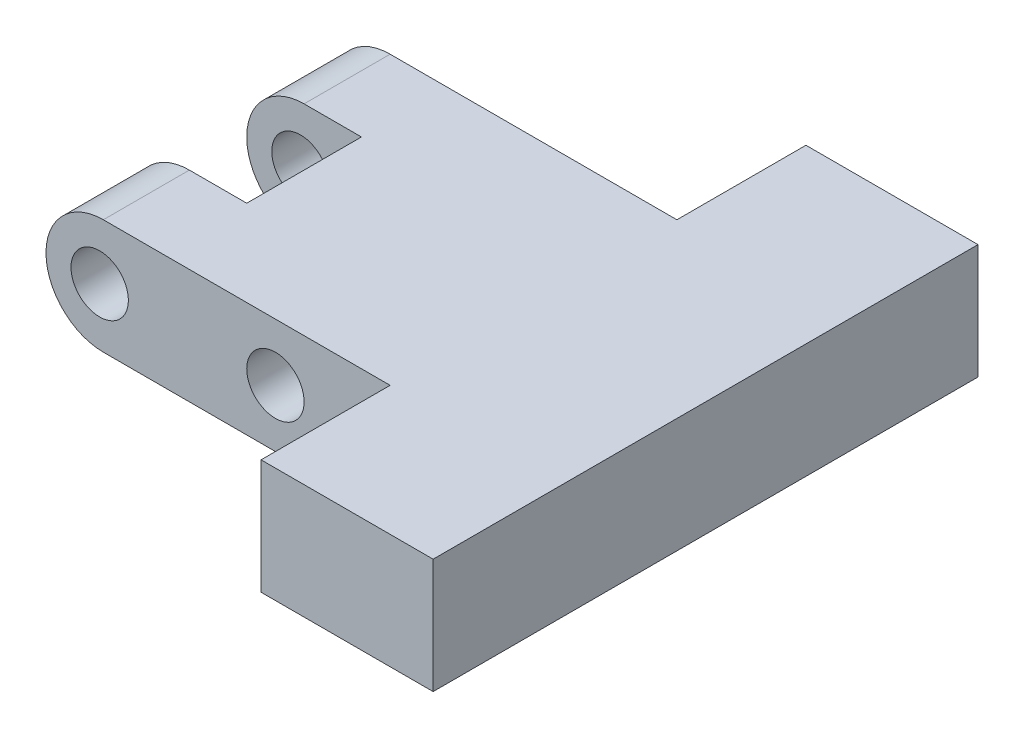
from build123d import *

# Parameters (mm, degrees)
SKETCH1_W           = 6
SKETCH1_H           = 19
SKETCH1_W_2         = 8
SKETCH1_H_2         = 10
BOSS_EXTRUDE1_DEPTH = 4
BOSS_EXTRUDE2_DEPTH = 3
BOSS_EXTRUDE3_START = -3
BOSS_EXTRUDE3_DEPTH = 3
SKETCH6_R           = 1
CUT_EXTRUDE1_DEPTH  = 14
SKETCH7_R           = 1
CUT_EXTRUDE2_DEPTH  = 14


with BuildPart() as part:
    # Sketch1 → Boss-Extrude1 (new body)
    with BuildSketch(Plane(origin=(0, 0, 0), x_dir=(1, 0, 0), z_dir=(0, 1, 0))):
        with Locations((3, 9.5)):
            Rectangle(SKETCH1_W, SKETCH1_H)
        with Locations((-4, 9.5)):
            Rectangle(SKETCH1_W_2, SKETCH1_H_2)
    extrude(amount=BOSS_EXTRUDE1_DEPTH)

    # Sketch2 → Boss-Extrude2 (add)
    with BuildSketch(Plane.XY.offset(-4.5)):
        with BuildLine():
            Line((-8, 0), (-10, 0))
            ThreePointArc((-10, 0), (-12, 2), (-10, 4))
            Line((-10, 4), (-8, 4))
            Line((-8, 4), (-8, 0))
        make_face()
    extrude(amount=-BOSS_EXTRUDE2_DEPTH)

    # Sketch5 → Boss-Extrude3 (add)
    with BuildSketch(Plane(origin=(0, 0, -14.5), x_dir=(-1, 0, 0), z_dir=(0, 0, -1)).offset(BOSS_EXTRUDE3_START)):
        with BuildLine():
            Line((8, 4), (10, 4))
            ThreePointArc((10, 4), (12, 2), (10, 0))
            Line((10, 0), (8, 0))
            Line((8, 0), (8, 4))
        make_face()
    extrude(amount=BOSS_EXTRUDE3_DEPTH)

    # Sketch6 → Cut-Extrude1 (cut)
    with BuildSketch(Plane(origin=(0, 0, -14.5), x_dir=(-1, 0, 0), z_dir=(0, 0, -1))):
        with Locations((10.127972383, 2)):
            Circle(SKETCH6_R)
    extrude(amount=-CUT_EXTRUDE1_DEPTH, mode=Mode.SUBTRACT)

    # Sketch7 → Cut-Extrude2 (cut)
    with BuildSketch(Plane(origin=(0, 0, -14.5), x_dir=(-1, 0, 0), z_dir=(0, 0, -1))):
        with Locations((4, 2)):
            Circle(SKETCH7_R)
    extrude(amount=-CUT_EXTRUDE2_DEPTH, mode=Mode.SUBTRACT)


solid = part.part
